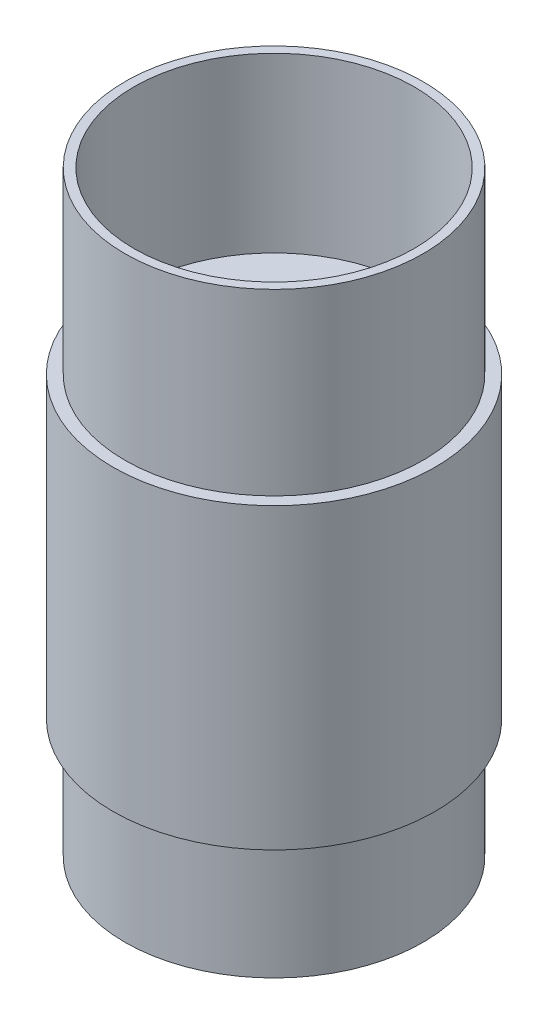
from build123d import *

# Parameters (mm, degrees)
ESBO_O1_R                = 25
ESBO_O1_R_2              = 23.5
RESSALTO_EXTRUS_O1_DEPTH = 20
ESBO_O2_R                = 27
ESBO_O2_R_2              = 25
RESSALTO_EXTRUS_O2_DEPTH = 50
ESBO_O3_R                = 25
ESBO_O3_R_2              = 23.5
RESSALTO_EXTRUS_O3_DEPTH = 30
ESBO_O18_R               = 24
RESSALTO_EXTRUS_O4_DEPTH = 1


with BuildPart() as part:
    # Esboço1 → Ressalto-extrusão1 (new body)
    with BuildSketch(Plane(origin=(0, 0, 0), x_dir=(1, 0, 0), z_dir=(0, 1, 0))):
        with Locations(Location((0, 0, 0), (0, 0, 270))):
            Circle(ESBO_O1_R)
        with Locations(Location((0, 0, 0), (0, 0, 270))):
            Circle(ESBO_O1_R_2, mode=Mode.SUBTRACT)
    extrude(amount=RESSALTO_EXTRUS_O1_DEPTH)


with BuildPart() as body_2:
    # Esboço2 → Ressalto-extrusão2 (new body)
    with BuildSketch(Plane(origin=(0, 20, 0), x_dir=(1, 0, 0), z_dir=(0, 1, 0))):
        with Locations(Location((0, 0, 0), (0, 0, 270))):
            Circle(ESBO_O2_R)
        with Locations(Location((0, 0, 0), (0, 0, 270))):
            Circle(ESBO_O2_R_2, mode=Mode.SUBTRACT)
    extrude(amount=RESSALTO_EXTRUS_O2_DEPTH)


with BuildPart() as body_3:
    # Esboço3 → Ressalto-extrusão3 (new body)
    with BuildSketch(Plane(origin=(0, 70, 0), x_dir=(1, 0, 0), z_dir=(0, 1, 0))):
        with Locations(Location((0, 0, 0), (0, 0, 270))):
            Circle(ESBO_O3_R)
        with Locations(Location((0, 0, 0), (0, 0, 270))):
            Circle(ESBO_O3_R_2, mode=Mode.SUBTRACT)
    extrude(amount=RESSALTO_EXTRUS_O3_DEPTH)

    # Esboço18 → Ressalto-extrusão4 (add)
    with BuildSketch(Plane(origin=(0, 70, 0), x_dir=(1, 0, 0), z_dir=(0, 1, 0))):
        Circle(ESBO_O18_R)
    extrude(amount=RESSALTO_EXTRUS_O4_DEPTH)


solid = Compound([part.part, body_2.part, body_3.part])
